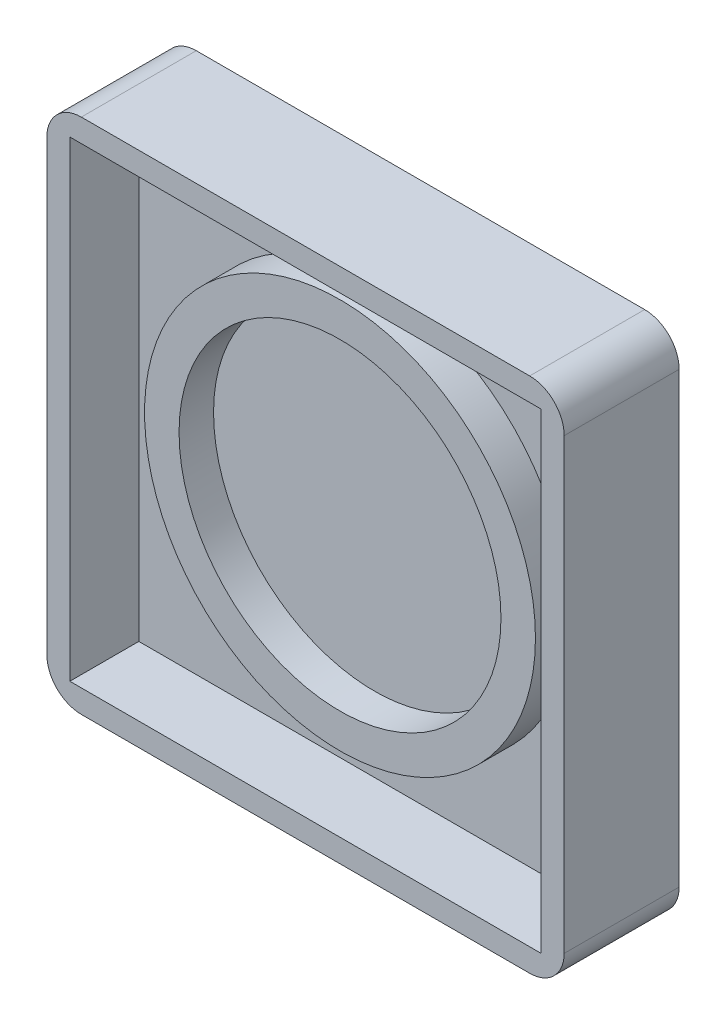
from build123d import *

# Parameters (mm, degrees)
SKETCH1_W           = 45
SKETCH1_H           = 45
BOSS_EXTRUDE1_DEPTH = 10
SKETCH2_W           = 41
SKETCH2_H           = 41
CUT_EXTRUDE1_DEPTH  = 6
SKETCH3_R           = 17
SKETCH3_R_2         = 14
BOSS_EXTRUDE2_DEPTH = 3
FILLET2_R           = 3


with BuildPart() as part:
    # Sketch1 → Boss-Extrude1 (new body)
    with BuildSketch(Plane.XY):
        Rectangle(SKETCH1_W, SKETCH1_H)
    extrude(amount=BOSS_EXTRUDE1_DEPTH)

    # Sketch2 → Cut-Extrude1 (cut)
    with BuildSketch(Plane.XY.offset(10)):
        Rectangle(SKETCH2_W, SKETCH2_H)
    extrude(amount=-CUT_EXTRUDE1_DEPTH, mode=Mode.SUBTRACT)

    # Sketch3 → Boss-Extrude2 (add)
    with BuildSketch(Plane.XY.offset(4)):
        Circle(SKETCH3_R)
        Circle(SKETCH3_R_2, mode=Mode.SUBTRACT)
    extrude(amount=BOSS_EXTRUDE2_DEPTH)

    # Fillet2
    fillet2_edges = [part.edges().sort_by_distance(p)[0] for p in [
        (-22.5, 22.5, 5),
        (22.5, 22.5, 5),
        (22.5, -22.5, 5),
        (-22.5, -22.5, 5),
    ]]
    fillet(fillet2_edges, radius=FILLET2_R)


solid = part.part
